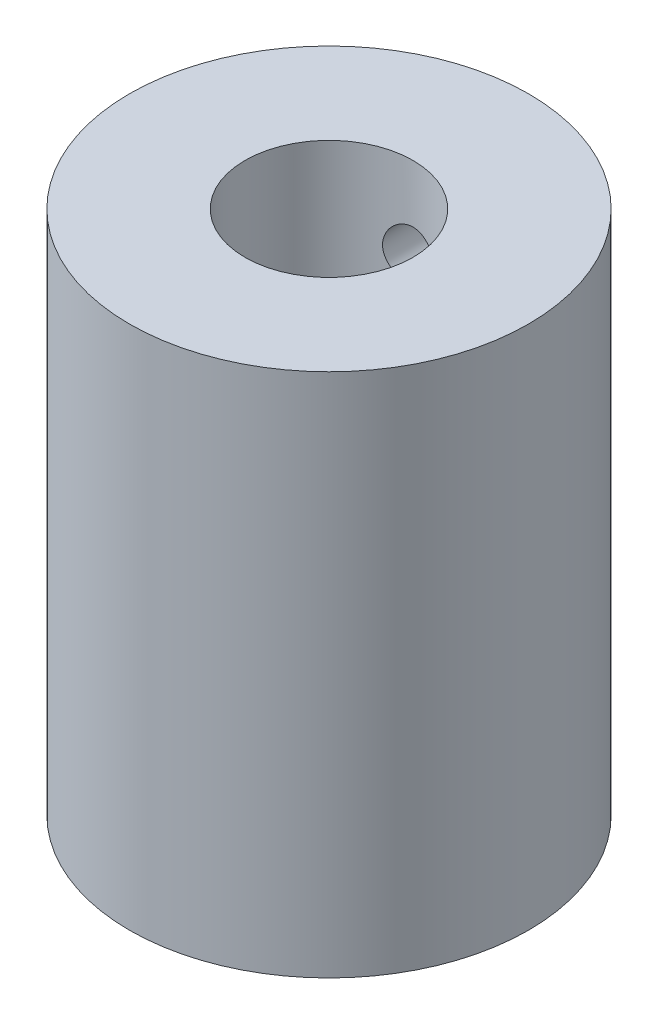
from build123d import *

# Parameters (mm, degrees)
SKETCH1_R           = 9.5
BOSS_EXTRUDE1_DEPTH = 25
SKETCH2_R           = 4
CUT_EXTRUDE1_DEPTH  = 12.5
SKETCH3_R           = 2.5
CUT_EXTRUDE2_DEPTH  = 12.5
SKETCH4_R           = 1.25
CUT_EXTRUDE3_DEPTH  = 12.5


with BuildPart() as part:
    # Sketch1 → Boss-Extrude1 (new body)
    with BuildSketch(Plane(origin=(0, 0, 0), x_dir=(1, 0, 0), z_dir=(0, 1, 0))):
        with Locations(Location((0, 0, 0), (0, 0, 270))):
            Circle(SKETCH1_R)
    extrude(amount=BOSS_EXTRUDE1_DEPTH)

    # Sketch2 → Cut-Extrude1 (cut)
    with BuildSketch(Plane(origin=(0, 25, 0), x_dir=(1, 0, 0), z_dir=(0, 1, 0))):
        with Locations(Location((0, 0, 0), (0, 0, 270))):
            Circle(SKETCH2_R)
    extrude(amount=-CUT_EXTRUDE1_DEPTH, mode=Mode.SUBTRACT)

    # Sketch3 → Cut-Extrude2 (cut)
    with BuildSketch(Plane.XZ):
        with Locations(Location((0, 0, 0), (0, 0, 270))):
            Circle(SKETCH3_R)
    extrude(amount=-CUT_EXTRUDE2_DEPTH, mode=Mode.SUBTRACT)

    # Sketch4 → Cut-Extrude3 (cut)
    with BuildSketch(Plane.XY):
        with Locations(Location((0, 4, 0), (0, 0, 90))):
            Circle(SKETCH4_R)
        with Locations((0, 21)):
            Circle(SKETCH4_R)
    extrude(amount=-CUT_EXTRUDE3_DEPTH, mode=Mode.SUBTRACT)


solid = part.part
